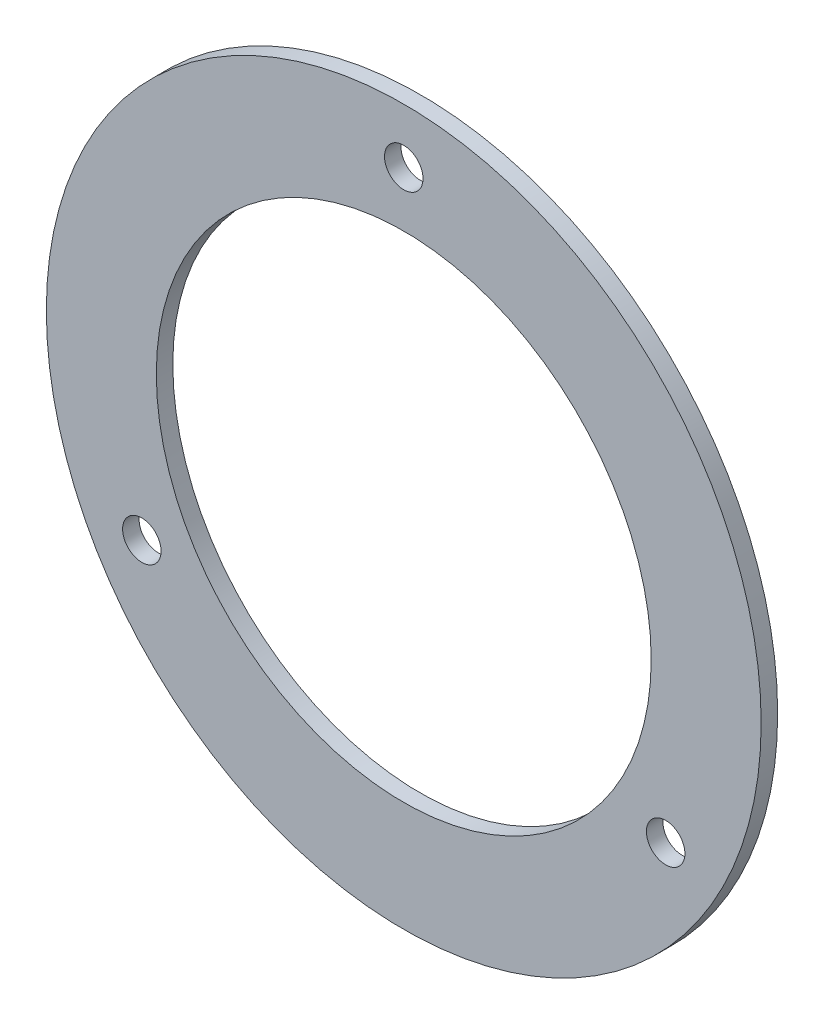
from build123d import *

# Parameters (mm, degrees)
SKETCH1_R           = 65
SKETCH1_R_2         = 45
BOSS_EXTRUDE1_DEPTH = 3
SKETCH2_R           = 3.5
CUT_EXTRUDE1_DEPTH  = 3
CIRPATTERN1_COUNT   = 3


with BuildPart() as part:
    # Sketch1 → Boss-Extrude1 (new body)
    with BuildSketch(Plane.XY):
        Circle(SKETCH1_R)
        Circle(SKETCH1_R_2, mode=Mode.SUBTRACT)
    extrude(amount=BOSS_EXTRUDE1_DEPTH)

    # Sketch2 → Cut-Extrude1 (cut)
    with BuildSketch(Plane.XY.offset(3)):
        with Locations((0, 55)):
            Circle(SKETCH2_R)
    cut_extrude1 = extrude(amount=-CUT_EXTRUDE1_DEPTH, mode=Mode.SUBTRACT)

    # CirPattern1: Cut-Extrude1 ×3 about axis
    cirpattern1_axis = Axis((0, 0, 0), (0, 0, 1))
    for i in range(1, CIRPATTERN1_COUNT):
        add(cut_extrude1.rotate(cirpattern1_axis, i * 360 / CIRPATTERN1_COUNT), mode=Mode.SUBTRACT)


solid = part.part
